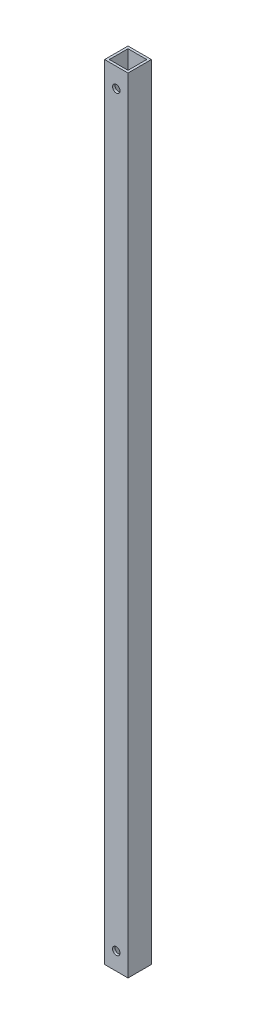
from build123d import *

# Parameters (mm, degrees)
SKETCH_1_W          = 10
SKETCH_1_H          = 335
SKETCH_1_R          = 1.6
EXTRUDE_1_DEPTH     = 10
SKETCH_2_W          = 8
SKETCH_2_H          = 8
CUT_EXTRUDE_1_DEPTH = 1000


with BuildPart() as part:
    # ｽｹｯﾁ1 → ﾎﾞｽ - 押し出し1 (new body)
    with BuildSketch(Plane.XY):
        with Locations((5, 167.5)):
            Rectangle(SKETCH_1_W, SKETCH_1_H)
        with Locations((5, 326.683332908)):
            Circle(SKETCH_1_R, mode=Mode.SUBTRACT)
        with Locations((5, 7.5)):
            Circle(SKETCH_1_R, mode=Mode.SUBTRACT)
    extrude(amount=EXTRUDE_1_DEPTH)

    # ｽｹｯﾁ2 → ｶｯﾄ - 押し出し1 (cut)
    with BuildSketch(Plane.XZ):
        with Locations((5, 5)):
            Rectangle(SKETCH_2_W, SKETCH_2_H)
    extrude(amount=-CUT_EXTRUDE_1_DEPTH, mode=Mode.SUBTRACT)


solid = part.part
